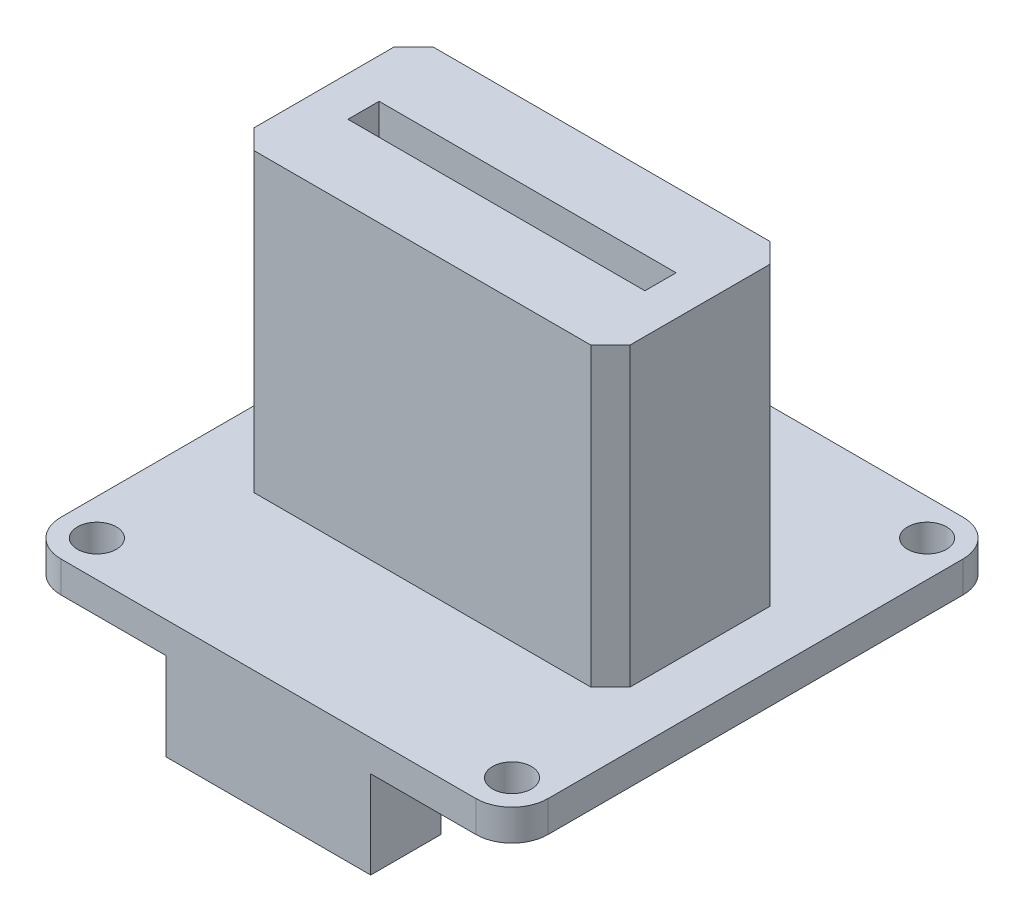
from build123d import *

# Parameters (mm, degrees)
SKETCH_2_R          = 1
EXTRUDE_3_DEPTH     = 1.6
EXTRUDE_START       = 1.6
SKETCH_3_W          = 19.3
SKETCH_3_H          = 9.2
EXTRUDE_4_DEPTH     = 15.2
CUT_EXTRUDE_START   = 16.8
SKETCH_4_W          = 15.24
SKETCH_4_H          = 1.6
CUT_EXTRUDE_1_DEPTH = 9
CUT_EXTRUDE_2_DEPTH = 15.2
SKETCH_6_W          = 10.5
SKETCH_6_H          = 3.6
SKETCH_6_W_2        = 15
EXTRUDE_5_DEPTH     = 4.5


with BuildPart() as part:
    # 草图2 → 凸台-拉伸3 (new body)
    with BuildSketch(Plane(origin=(0, 0, 0), x_dir=(1, 0, 0), z_dir=(0, 1, 0))):
        with BuildLine():
            Line((-10.65, 12.5), (10.65, 12.5))
            ThreePointArc((10.65, 12.5), (11.958147545, 11.958147545), (12.5, 10.65))
            Line((12.5, 10.65), (12.5, -10.65))
            ThreePointArc((12.5, -10.65), (11.958147545, -11.958147545), (10.65, -12.5))
            Line((10.65, -12.5), (-10.65, -12.5))
            ThreePointArc((-10.65, -12.5), (-11.958147545, -11.958147545), (-12.5, -10.65))
            Line((-12.5, -10.65), (-12.5, 10.65))
            ThreePointArc((-12.5, 10.65), (-11.958147545, 11.958147545), (-10.65, 12.5))
        make_face()
        with Locations(Location((-10.65, 10.65, 0), (0, 0, 270))):
            Circle(SKETCH_2_R, mode=Mode.SUBTRACT)
        with Locations(Location((10.65, 10.65, 0), (0, 0, 270))):
            Circle(SKETCH_2_R, mode=Mode.SUBTRACT)
        with Locations(Location((-10.65, -10.65, 0), (0, 0, 270))):
            Circle(SKETCH_2_R, mode=Mode.SUBTRACT)
        with Locations(Location((10.65, -10.65, 0), (0, 0, 270))):
            Circle(SKETCH_2_R, mode=Mode.SUBTRACT)
    extrude(amount=EXTRUDE_3_DEPTH)

    # 草图3 → 凸台-拉伸4 (add)
    with BuildSketch(Plane(origin=(0, 0, 0), x_dir=(1, 0, 0), z_dir=(0, 1, 0)).offset(EXTRUDE_START)):
        Rectangle(SKETCH_3_W, SKETCH_3_H)
    extrude(amount=EXTRUDE_4_DEPTH)

    # 草图4 → 切除-拉伸1 (cut)
    with BuildSketch(Plane(origin=(0, 0, 0), x_dir=(1, 0, 0), z_dir=(0, 1, 0)).offset(CUT_EXTRUDE_START)):
        Rectangle(SKETCH_4_W, SKETCH_4_H)
    extrude(amount=-CUT_EXTRUDE_1_DEPTH, mode=Mode.SUBTRACT)

    # 草图5 → 切除-拉伸2 (cut)
    with BuildSketch(Plane(origin=(0, 0, 0), x_dir=(1, 0, 0), z_dir=(0, 1, 0)).offset(CUT_EXTRUDE_START)):
        Polygon((9.65, 4.6), (9.65, 3.6), (8.65, 4.6), align=None)
        Polygon((9.65, -4.6), (9.65, -3.6), (8.65, -4.6), align=None)
        Polygon((-9.65, -4.6), (-8.65, -4.6), (-9.65, -3.6), align=None)
        Polygon((-9.65, 4.6), (-8.65, 4.6), (-9.65, 3.6), align=None)
    extrude(amount=-CUT_EXTRUDE_2_DEPTH, mode=Mode.SUBTRACT)

    # 草图6 → 凸台-拉伸5 (add)
    with BuildSketch(Plane(origin=(0, 0, 0), x_dir=(1, 0, 0), z_dir=(0, 1, 0))):
        with Locations((0, -10.7)):
            Rectangle(SKETCH_6_W, SKETCH_6_H)
        with Locations((0, 10.7)):
            Rectangle(SKETCH_6_W_2, SKETCH_6_H)
    extrude(amount=-EXTRUDE_5_DEPTH)


solid = part.part
